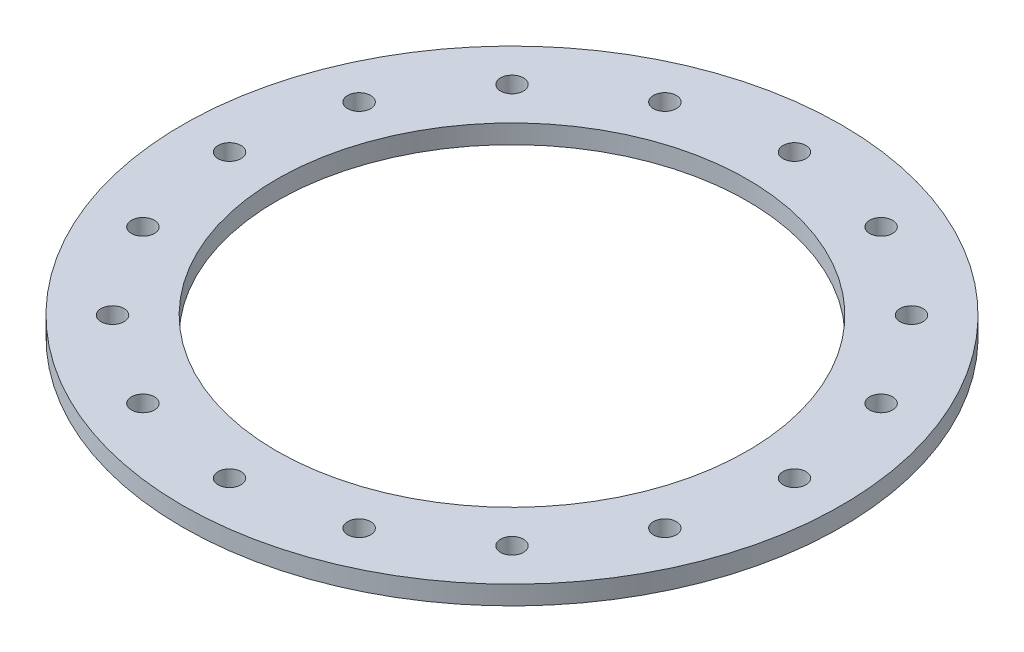
from build123d import *

# Parameters (mm, degrees)
SKETCH1_R           = 175
SKETCH1_R_2         = 125
SKETCH1_R_3         = 6.1
BOSS_EXTRUDE1_DEPTH = 5


with BuildPart() as part:
    # Sketch1 → Boss-Extrude1 (new, symmetric)
    with BuildSketch(Plane(origin=(0, 0, 0), x_dir=(1, 0, 0), z_dir=(0, 1, 0))):
        with Locations(Location((0, 0, 0), (0, 0, 270))):
            Circle(SKETCH1_R)
        with Locations(Location((0, 0, 0), (0, 0, 270))):
            Circle(SKETCH1_R_2, mode=Mode.SUBTRACT)
        with Locations(Location((0, 150, 0), (0, 0, 270))):
            Circle(SKETCH1_R_3, mode=Mode.SUBTRACT)
        with Locations(Location((57.402514855, 138.581929877, 0), (0, 0, 270))):
            Circle(SKETCH1_R_3, mode=Mode.SUBTRACT)
        with Locations(Location((106.066017178, 106.066017178, 0), (0, 0, 270))):
            Circle(SKETCH1_R_3, mode=Mode.SUBTRACT)
        with Locations(Location((138.581929877, 57.402514855, 0), (0, 0, 270))):
            Circle(SKETCH1_R_3, mode=Mode.SUBTRACT)
        with Locations(Location((150, 0, 0), (0, 0, 270))):
            Circle(SKETCH1_R_3, mode=Mode.SUBTRACT)
        with Locations(Location((138.581929877, -57.402514855, 0), (0, 0, 270))):
            Circle(SKETCH1_R_3, mode=Mode.SUBTRACT)
        with Locations(Location((106.066017178, -106.066017178, 0), (0, 0, 270))):
            Circle(SKETCH1_R_3, mode=Mode.SUBTRACT)
        with Locations(Location((57.402514855, -138.581929877, 0), (0, 0, 270))):
            Circle(SKETCH1_R_3, mode=Mode.SUBTRACT)
        with Locations(Location((0, -150, 0), (0, 0, 270))):
            Circle(SKETCH1_R_3, mode=Mode.SUBTRACT)
        with Locations(Location((-57.402514855, -138.581929877, 0), (0, 0, 270))):
            Circle(SKETCH1_R_3, mode=Mode.SUBTRACT)
        with Locations(Location((-106.066017178, -106.066017178, 0), (0, 0, 270))):
            Circle(SKETCH1_R_3, mode=Mode.SUBTRACT)
        with Locations(Location((-138.581929877, -57.402514855, 0), (0, 0, 270))):
            Circle(SKETCH1_R_3, mode=Mode.SUBTRACT)
        with Locations(Location((-150, 0, 0), (0, 0, 270))):
            Circle(SKETCH1_R_3, mode=Mode.SUBTRACT)
        with Locations(Location((-138.581929877, 57.402514855, 0), (0, 0, 270))):
            Circle(SKETCH1_R_3, mode=Mode.SUBTRACT)
        with Locations(Location((-106.066017178, 106.066017178, 0), (0, 0, 270))):
            Circle(SKETCH1_R_3, mode=Mode.SUBTRACT)
        with Locations(Location((-57.402514855, 138.581929877, 0), (0, 0, 270))):
            Circle(SKETCH1_R_3, mode=Mode.SUBTRACT)
    extrude(amount=BOSS_EXTRUDE1_DEPTH, both=True)


solid = part.part
